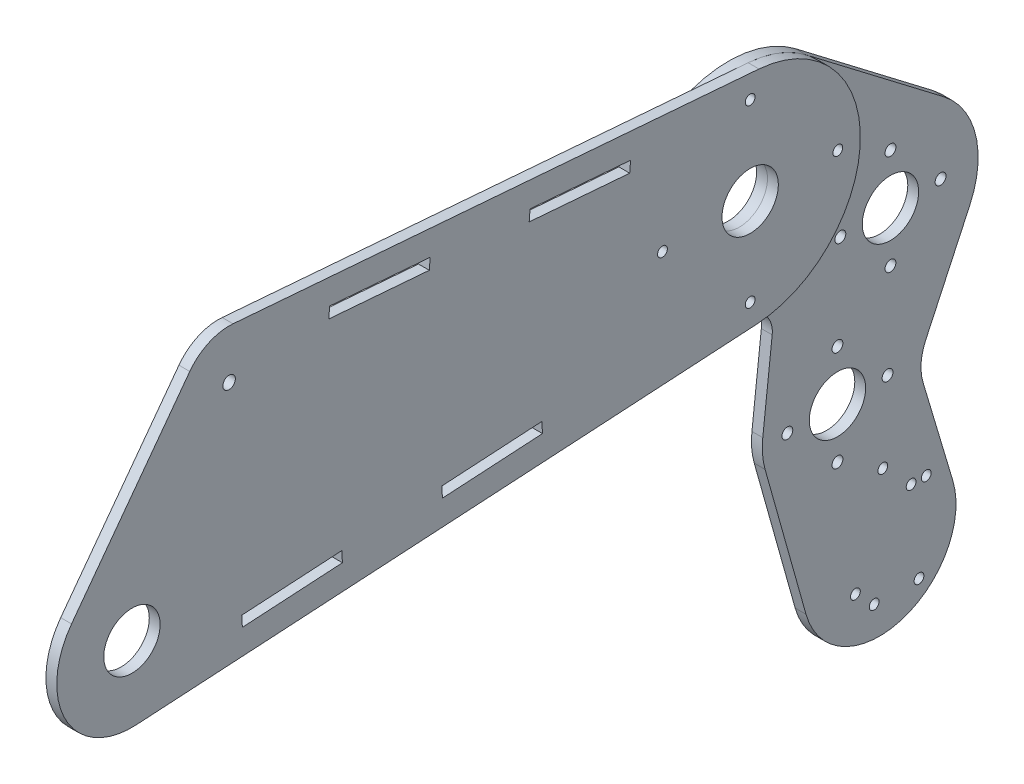
from build123d import *

# Parameters (mm, degrees)
PLACA_R                 = 3.175
PLACA_R_2               = 14.2875
PLACA_R_3               = 2.4892
EXTRUCI_N_INTAKE_DEPTH  = 5.5
PLACA_6_R               = 2.4892
PLACA_6_R_2             = 14.2875
PLACA_6_R_3             = 2.75
EXTRUCI_N_PIBOTE_DEPTH  = 5.5
PLACA_8_R               = 2.75
PLACA_8_R_2             = 14.2875
PLACA_8_R_3             = 2.4892
SALIENTE_EXTRUIR4_DEPTH = 5.5
REDONDEO1_R             = 25.4


with BuildPart() as part:
    # Placa → Extrución Intake (new body)
    with BuildSketch(Plane(origin=(0, 0, 0), x_dir=(0, 0, -1), z_dir=(1, 0, 0))):
        with BuildLine():
            Line((-647.719071273, 255.952181515), (-707.647679612, 175.084714979))
            ThreePointArc((-707.647679612, 175.084714979), (-710.544063401, 134.264766276), (-674.78485327, 114.366622092))
            Line((-674.78485327, 114.366622092), (-360.337063596, 132.98665008))
            ThreePointArc((-360.337063596, 132.98665008), (-307.763324511, 188.179166762), (-359.160385792, 244.46907732))
            Line((-359.160385792, 244.46907732), (-625.790367871, 265.913476285))
            ThreePointArc((-625.790367871, 265.913476285), (-638.044127864, 263.771320547), (-647.719071273, 255.952181515))
        make_face()
        Polygon((-570.663026169, 138.764077259), (-570.337913124, 133.273694622), (-621.049083669, 130.270832316), (-621.374196714, 135.761214953), align=None, mode=Mode.SUBTRACT)
        Polygon((-519.62674258, 136.276556928), (-519.951855625, 141.766939566), (-469.240685081, 144.769801872), (-468.915572036, 139.279419234), align=None, mode=Mode.SUBTRACT)
        Polygon((-576.816297666, 249.233601949), (-525.852788248, 245.134731221), (-526.293716038, 239.652434013), (-577.257225455, 243.75130474), align=None, mode=Mode.SUBTRACT)
        with Locations((-627.779953869, 241.175861584)):
            Circle(PLACA_R, mode=Mode.SUBTRACT)
        Polygon((-424.693716038, 231.480993885), (-475.657225455, 235.579864612), (-475.216297666, 241.062161821), (-424.252788248, 236.963291093), align=None, mode=Mode.SUBTRACT)
        with Locations((-677.037, 152.4)):
            Circle(PLACA_R_2, mode=Mode.SUBTRACT)
        with Locations((-363.640212133, 233.218937679)):
            Circle(PLACA_R_3, mode=Mode.SUBTRACT)
        with Locations((-363.640212133, 144.318937679)):
            Circle(PLACA_R_3, mode=Mode.SUBTRACT)
        with Locations((-408.090212133, 188.768937679)):
            Circle(PLACA_R_3, mode=Mode.SUBTRACT)
        with Locations((-363.640212133, 188.768937679)):
            Circle(PLACA_R_2, mode=Mode.SUBTRACT)
        with Locations((-319.190212133, 188.768937679)):
            Circle(PLACA_R_3, mode=Mode.SUBTRACT)
    extrude(amount=EXTRUCI_N_INTAKE_DEPTH)


with BuildPart() as body_2:
    # Placa<6> → Extrución Pibote (new body)
    with BuildSketch(Plane(origin=(0, 0, 0), x_dir=(0, 0, -1), z_dir=(1, 0, 0))):
        with BuildLine():
            ThreePointArc((-360.337063596, 132.98665008), (-350.374926539, 129.051838303), (-346.964950193, 118.898071525))
            Line((-346.964950193, 118.898071525), (-351.744821708, 76.135623236))
            ThreePointArc((-351.744821708, 76.135623236), (-310.483459841, 33.955021156), (-277.370245178, 82.793716773))
            Line((-277.370245178, 82.793716773), (-273.235294143, 68.931238343))
            Line((-273.235294143, 68.931238343), (-246.71834862, 125.866666066))
            ThreePointArc((-246.71834862, 125.866666066), (-243.85110643, 155.258324547), (-260.0346927, 179.960190903))
            Line((-260.0346927, 179.960190903), (-329.72521686, 233.180056734))
            ThreePointArc((-329.72521686, 233.180056734), (-417.081556066, 205.09674092), (-360.337063596, 132.98665008))
        make_face()
        with Locations((-363.640212133, 144.318937679)):
            Circle(PLACA_6_R, mode=Mode.SUBTRACT)
        with Locations((-408.090212133, 188.768937679)):
            Circle(PLACA_6_R, mode=Mode.SUBTRACT)
        with Locations((-363.640212133, 188.768937679)):
            Circle(PLACA_6_R_2, mode=Mode.SUBTRACT)
        with Locations((-319.190212133, 188.768937679)):
            Circle(PLACA_6_R, mode=Mode.SUBTRACT)
        with Locations((-363.640212133, 233.218937679)):
            Circle(PLACA_6_R, mode=Mode.SUBTRACT)
        with Locations((-261.612529849, 144.633164383)):
            Circle(PLACA_6_R_3, mode=Mode.SUBTRACT)
        with Locations((-287.012529849, 170.033164383)):
            Circle(PLACA_6_R_3, mode=Mode.SUBTRACT)
        with Locations((-287.012529849, 144.633164383)):
            Circle(PLACA_6_R_2, mode=Mode.SUBTRACT)
        with Locations((-312.412529849, 144.633164383)):
            Circle(PLACA_6_R_3, mode=Mode.SUBTRACT)
        with Locations((-287.012529849, 119.233164383)):
            Circle(PLACA_6_R_3, mode=Mode.SUBTRACT)
        with Locations((-313.880628229, 97.303265476)):
            Circle(PLACA_6_R_3, mode=Mode.SUBTRACT)
        with Locations((-313.880628229, 46.503265476)):
            Circle(PLACA_6_R_3, mode=Mode.SUBTRACT)
        with Locations((-339.280628229, 71.903265476)):
            Circle(PLACA_6_R_3, mode=Mode.SUBTRACT)
        with Locations((-313.880628229, 71.903265476)):
            Circle(PLACA_6_R_2, mode=Mode.SUBTRACT)
        with Locations((-288.480628229, 71.903265476)):
            Circle(PLACA_6_R_3, mode=Mode.SUBTRACT)
    extrude(amount=-EXTRUCI_N_PIBOTE_DEPTH)

    # Placa<8> → Saliente-Extruir4 (add)
    with BuildSketch(Plane(origin=(0, 0, 0), x_dir=(0, 0, -1), z_dir=(1, 0, 0))):
        with BuildLine():
            ThreePointArc((-277.370245178, 82.793716773), (-324.468968901, 108.502405381), (-350.566025176, 61.61775864))
            Line((-350.566025176, 61.61775864), (-329.82429477, -12.36193195))
            ThreePointArc((-329.82429477, -12.36193195), (-281.762661525, -39.114125571), (-255.408585106, 9.166958819))
            Line((-255.408585106, 9.166958819), (-277.370245178, 82.793716773))
        make_face()
        with Locations((-313.880628229, 46.503265476)):
            Circle(PLACA_8_R, mode=Mode.SUBTRACT)
        with Locations((-339.280628229, 71.903265476)):
            Circle(PLACA_8_R, mode=Mode.SUBTRACT)
        with Locations((-313.880628229, 71.903265476)):
            Circle(PLACA_8_R_2, mode=Mode.SUBTRACT)
        with Locations((-288.480628229, 71.903265476)):
            Circle(PLACA_8_R, mode=Mode.SUBTRACT)
        with Locations((-313.880628229, 97.303265476)):
            Circle(PLACA_8_R, mode=Mode.SUBTRACT)
        with Locations((-290.8808, 32.258)):
            Circle(PLACA_8_R_3, mode=Mode.SUBTRACT)
        with Locations((-268.859, 18.034)):
            Circle(PLACA_8_R_3, mode=Mode.SUBTRACT)
        with Locations((-304.8, -16.002)):
            Circle(PLACA_8_R_3, mode=Mode.SUBTRACT)
        with Locations((-295.275, -25.273)):
            Circle(PLACA_8_R_3, mode=Mode.SUBTRACT)
        with Locations((-272.542, -25.273)):
            Circle(PLACA_8_R_3, mode=Mode.SUBTRACT)
        with Locations((-276.5298, 18.034)):
            Circle(PLACA_8_R_3, mode=Mode.SUBTRACT)
    extrude(amount=-SALIENTE_EXTRUIR4_DEPTH)

    # Redondeo1
    redondeo1_edges = [body_2.edges().sort_by_distance(p)[0] for p in [
        (-2.75, 68.931238343, 273.235294143),
    ]]
    fillet(redondeo1_edges, radius=REDONDEO1_R)


solid = Compound([part.part, body_2.part])
